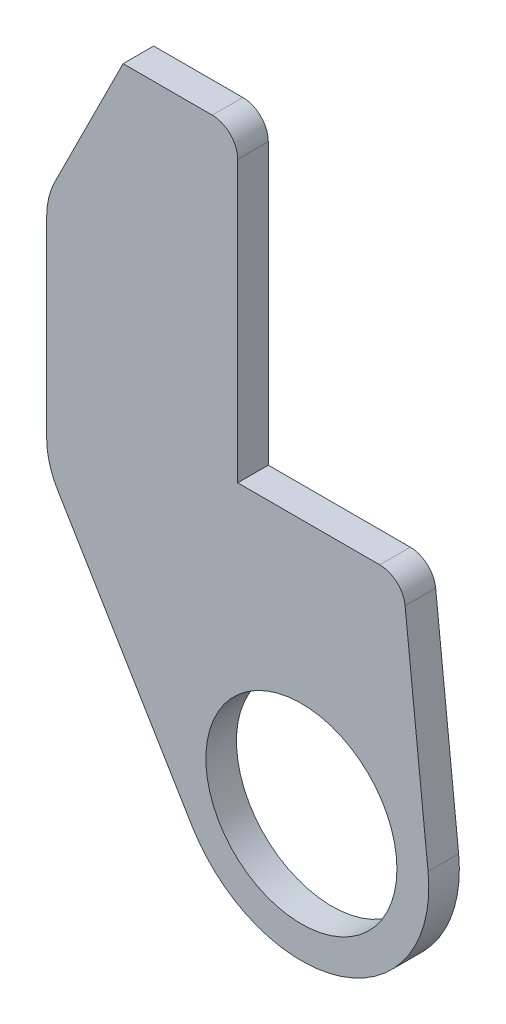
from build123d import *

# Parameters (mm, degrees)
SKETCH_1_R      = 37.5
EXTRUDE_1_DEPTH = 12
FILLET_1_R      = 10
FILLET_2_R      = 30


with BuildPart() as part:
    # 草图1 → 凸台-拉伸1 (new body)
    with BuildSketch(Plane.XY):
        with BuildLine():
            Line((-42.858365035, -25.751903746), (-100, 69.347746915))
            Line((-100, 69.347746915), (-100, 160))
            Line((-100, 160), (-70, 220))
            Line((-70, 220), (-25, 220))
            Line((-25, 220), (-25, 100))
            Line((-25, 100), (39.764990452, 100))
            Line((39.764990452, 100), (49.726094768, 5.226423163))
            ThreePointArc((49.726094768, 5.226423163), (15.86523282, -47.41618276), (-42.858365035, -25.751903746))
        make_face()
        Circle(SKETCH_1_R, mode=Mode.SUBTRACT)
    extrude(amount=EXTRUDE_1_DEPTH)

    # 圆角1
    fillet_1_edges = [part.edges().sort_by_distance(p)[0] for p in [
        (-25, 220, 6),
        (39.764990452, 100, 6),
    ]]
    fillet(fillet_1_edges, radius=FILLET_1_R)

    # 圆角2
    fillet_2_edges = [part.edges().sort_by_distance(p)[0] for p in [
        (-100, 69.347746915, 6),
        (-100, 160, 6),
    ]]
    fillet(fillet_2_edges, radius=FILLET_2_R)


solid = part.part
